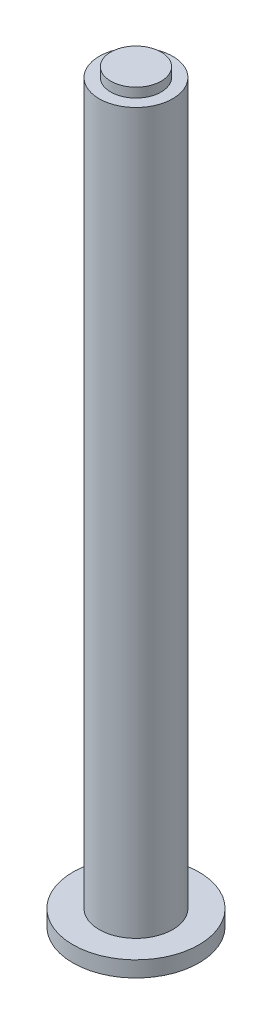
from build123d import *

# Parameters (mm, degrees)
SKETCH1_R         = 12
FOOT_FLANGE_DEPTH = 3
SKETCH2_R         = 7
LEG_DEPTH         = 140
SPIGOT_START      = 140
SKETCH3_R         = 4.8
SPIGOT_DEPTH      = 1.8


with BuildPart() as part:
    # Sketch1 → Foot_Flange (new body)
    with BuildSketch(Plane(origin=(0, 0, 0), x_dir=(1, 0, 0), z_dir=(0, 1, 0))):
        with Locations(Location((0, 0, 0), (0, 0, 270))):
            Circle(SKETCH1_R)
    extrude(amount=FOOT_FLANGE_DEPTH)

    # Sketch2 → Leg (add)
    with BuildSketch(Plane(origin=(0, 0, 0), x_dir=(1, 0, 0), z_dir=(0, 1, 0))):
        with Locations(Location((0, 0, 0), (0, 0, 270))):
            Circle(SKETCH2_R)
    extrude(amount=LEG_DEPTH)

    # Sketch3 → Spigot (add)
    with BuildSketch(Plane(origin=(0, 0, 0), x_dir=(1, 0, 0), z_dir=(0, 1, 0)).offset(SPIGOT_START)):
        with Locations(Location((0, 0, 0), (0, 0, 270))):
            Circle(SKETCH3_R)
    extrude(amount=SPIGOT_DEPTH)


solid = part.part
